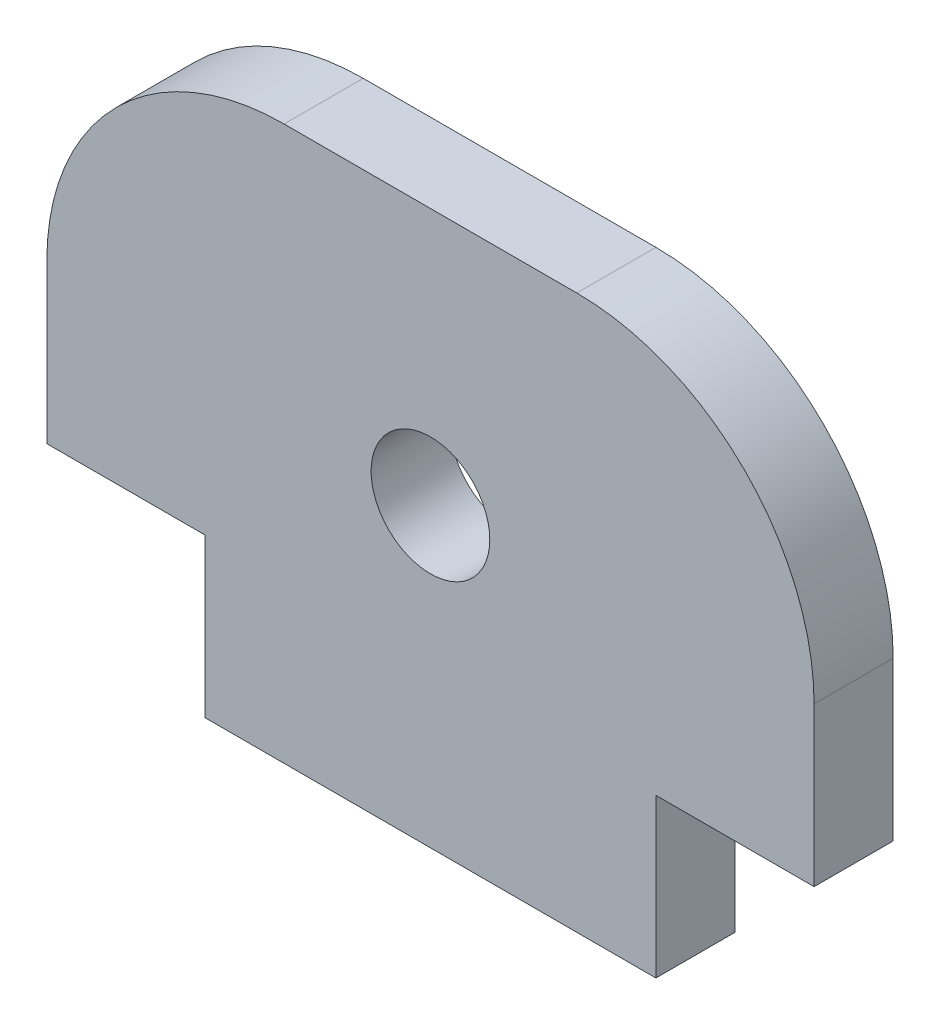
from build123d import *

# Parameters (mm, degrees)
MODEL_R             = 1.5
BOSS_EXTRUDE1_DEPTH = 2


with BuildPart() as part:
    # Model → Boss-Extrude1 (new body)
    with BuildSketch(Plane.XY):
        with BuildLine():
            Line((2118.494457195, 1218.298627523), (2118.494457195, 1222.298627523))
            ThreePointArc((2118.494457195, 1222.298627523), (2116.737097882, 1226.54126821), (2112.494457195, 1228.298627523))
            Line((2112.494457195, 1228.298627523), (2105.094457195, 1228.298627523))
            ThreePointArc((2105.094457195, 1228.298627523), (2100.851816508, 1226.54126821), (2099.094457195, 1222.298627523))
            Line((2099.094457195, 1222.298627523), (2099.094457195, 1218.298627523))
            Line((2099.094457195, 1218.298627523), (2103.094457195, 1218.298627523))
            Line((2103.094457195, 1218.298627523), (2103.094457195, 1214.298627523))
            Line((2103.094457195, 1214.298627523), (2114.494457195, 1214.298627523))
            Line((2114.494457195, 1214.298627523), (2114.494457195, 1218.298627523))
            Line((2114.494457195, 1218.298627523), (2118.494457195, 1218.298627523))
        make_face()
        with Locations((2108.794457195, 1221.798627523)):
            Circle(MODEL_R, mode=Mode.SUBTRACT)
    extrude(amount=BOSS_EXTRUDE1_DEPTH)


solid = part.part
